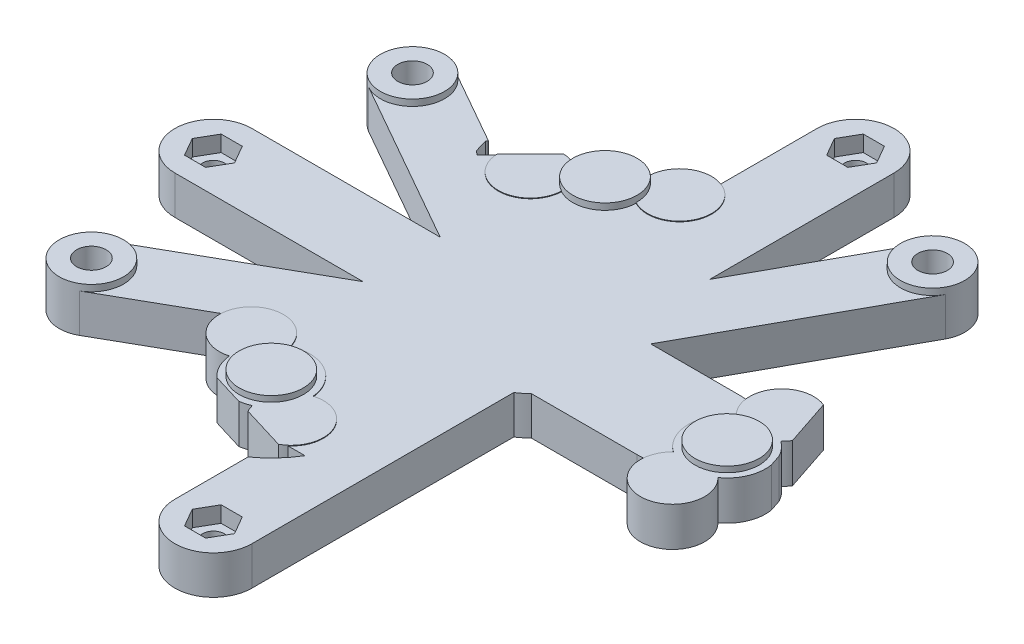
from build123d import *
from build123d.topology import SkipClean

# Parameters (mm, degrees)
BASE_OUTLINE_SKETCH_R          = 3.95
BASE_OUTLINE_SKETCH_R_2        = 1.6
BASE_OUTLINE_SKETCH_R_3        = 3.1
BASE_OUTLINE_SKETCH_R_4        = 2.3
BASE_OUTLINE_DEPTH             = 1.4
INTERFACE_PROFILE_2_SKETCH_R   = 3.95
INTERFACE_PROFILE_2_SKETCH_R_2 = 1.6
INTERFACE_PROFILE_2_SKETCH_R_3 = 1.7
INTERFACE_PROFILE_2_SKETCH_R_4 = 2.3
INTERFACE_PROFILE_2_DEPTH      = 0.1
INTERFACE_PROFILE_3_SKETCH_R   = 1.6
INTERFACE_PROFILE_3_SKETCH_R_2 = 1.7
INTERFACE_PROFILE_3_SKETCH_R_3 = 2.3
INTERFACE_PROFILE_3_DEPTH      = 0.5
INTERFACE_PROFILE_4_SKETCH_R   = 1.6
INTERFACE_PROFILE_4_SKETCH_R_2 = 1.7
INTERFACE_PROFILE_4_SKETCH_R_3 = 2.3
INTERFACE_PROFILE_4_DEPTH      = 1.5
INTERFACE_PROFILE_5_SKETCH_R   = 1.6
INTERFACE_PROFILE_5_SKETCH_R_2 = 2.3
INTERFACE_PROFILE_5_DEPTH      = 0.5
INTERFACE_PROFILE_6_SKETCH_R   = 1.1
INTERFACE_PROFILE_6_SKETCH_R_2 = 2.3
INTERFACE_PROFILE_6_DEPTH      = 1.3
INTERFACE_PROFILE_7_SKETCH_R   = 2.3
INTERFACE_PROFILE_7_DEPTH      = 0.7
INTERFACE_PROFILE_8_SKETCH_R   = 5
INTERFACE_PROFILE_8_SKETCH_R_2 = 2.3
INTERFACE_PROFILE_8_DEPTH      = 0.1
INTERFACE_PROFILE_9_SKETCH_R   = 5
INTERFACE_PROFILE_9_SKETCH_R_2 = 2.3
INTERFACE_PROFILE_9_DEPTH      = 0.9


with BuildPart() as part:
    # Base Outline Sketch → Base Outline (new body)
    with BuildSketch(Plane(origin=(0, -71, 0), x_dir=(1, 0, 0), z_dir=(0, 1, 0))):
        with BuildLine():
            Line((-32.291651246, 8), (-46.185295141, 8))
            Line((-46.185295141, 8), (-29.910571703, 37.590406251))
            ThreePointArc((-29.910571703, 37.590406251), (-31.882057497, 44.381079543), (-38.672730789, 42.409593749))
            Line((-38.672730789, 42.409593749), (-50.291651246, 21.284283828))
            Line((-50.291651246, 21.284283828), (-50.291651246, 50))
            ThreePointArc((-50.291651246, 50), (-56.291651246, 56), (-62.291651246, 50))
            Line((-62.291651246, 50), (-62.291651246, 34.954572734))
            ThreePointArc((-62.291651246, 34.954572734), (-66.315093544, 34.625464052), (-68.784082024, 31.431642464))
            ThreePointArc((-68.784082024, 31.431642464), (-68.883668242, 30.913025667), (-68.927999999, 30.386798062))
            ThreePointArc((-68.927999999, 30.386798062), (-73.791651246, 30.310889132), (-76.289215931, 26.136798062))
            ThreePointArc((-76.289215931, 26.136798062), (-77.35512684, 26.559413065), (-78.489286926, 26.728085547))
            Line((-78.489286926, 26.728085547), (-83.649541024, 21.548414964))
            ThreePointArc((-83.649541024, 21.548414964), (-83.643005829, 21.416889138), (-83.633009125, 21.285581035))
            Line((-83.633009125, 21.285581035), (-83.8107686, 21.386580737))
            Line((-83.8107686, 21.386580737), (-85.20343943, 19.988669705))
            Line((-85.20343943, 19.988669705), (-85.757211082, 20.413215201))
            ThreePointArc((-85.757211082, 20.413215201), (-86.105522751, 21.420146909), (-86.383835717, 22.448628496))
            Line((-86.383835717, 22.448628496), (-86.305419253, 22.677221962))
            Line((-86.305419253, 22.677221962), (-86.256166384, 22.776011296))
            Line((-86.256166384, 22.776011296), (-97.821604208, 29.347282787))
            ThreePointArc((-97.821604208, 29.347282787), (-104.638934033, 27.470047038), (-102.761698284, 20.652717213))
            Line((-102.761698284, 20.652717213), (-76.972915989, 6))
            Line((-76.972915989, 6), (-106.291651246, 6))
            ThreePointArc((-106.291651246, 6), (-112.291651246, 0), (-106.291651246, -6))
            Line((-106.291651246, -6), (-76.972915989, -6))
            Line((-76.972915989, -6), (-102.761698284, -20.652717213))
            ThreePointArc((-102.761698284, -20.652717213), (-105.125718578, -26.277416546), (-100.291651246, -30))
            ThreePointArc((-100.291651246, -30), (-99.0142347, -29.834067332), (-97.821604208, -29.347282787))
            Line((-97.821604208, -29.347282787), (-83.633009125, -21.285581035))
            ThreePointArc((-83.633009125, -21.285581035), (-81.833429855, -25.588743588), (-77.266036714, -26.53458364))
            ThreePointArc((-77.266036714, -26.53458364), (-76.660851993, -28.65876199), (-75.328083566, -30.420042925))
            Line((-75.328083566, -30.420042925), (-70.4166073, -31.916610671))
            ThreePointArc((-70.4166073, -31.916610671), (-69.583050502, -31.73234307), (-68.784082024, -31.431642464))
            ThreePointArc((-68.784082024, -31.431642464), (-68.607205612, -31.999326383), (-68.36419026, -32.541999246))
            Line((-68.36419026, -32.541999246), (-61.538896036, -34.621723271))
            ThreePointArc((-61.538896036, -34.621723271), (-61.075070248, -34.33525847), (-60.645188633, -34))
            Line((-60.645188633, -34), (-58.027344867, -34))
            ThreePointArc((-58.027344867, -34), (-59.924361539, -36.5180637), (-62.291651246, -38.600191578))
            Line((-62.291651246, -38.600191578), (-62.291651246, -50))
            ThreePointArc((-62.291651246, -50), (-56.291651246, -56), (-50.291651246, -50))
            Line((-50.291651246, -50), (-50.291651246, -9.219544457))
            ThreePointArc((-50.291651246, -9.219544457), (-49.489348292, -8.644574861), (-48.741816811, -8))
            Line((-48.741816811, -8), (-32.291651246, -8))
            ThreePointArc((-32.291651246, -8), (-31.774449966, -7.983263921), (-31.259412667, -7.933125709))
            ThreePointArc((-31.259412667, -7.933125709), (-24.59824207, -13.204504795), (-22.824835001, -4.897058824))
            ThreePointArc((-22.824835001, -4.897058824), (-20.756368573, -2.315306833), (-20.370627571, 0.970298223))
            Line((-20.370627571, 0.970298223), (-20.9711323, 2.773459598))
            ThreePointArc((-20.9711323, 2.773459598), (-21.771503753, 3.945664284), (-22.824835001, 4.897058824))
            ThreePointArc((-22.824835001, 4.897058824), (-22.387173453, 5.376691952), (-22.015356327, 5.908995993))
            Line((-22.015356327, 5.908995993), (-24.422675355, 13.137556374))
            ThreePointArc((-24.422675355, 13.137556374), (-29.320205782, 12.478423987), (-31.259412667, 7.933125709))
            ThreePointArc((-31.259412667, 7.933125709), (-31.774449966, 7.983263921), (-32.291651246, 8))
        make_face()
        with Locations(Location((-71.291651246, -25.980762114, 0), (0, 0, 270))):
            Circle(BASE_OUTLINE_SKETCH_R, mode=Mode.SUBTRACT)
        with Locations(Location((-63.930435314, -30.230762114, 0), (0, 0, 270))):
            Circle(BASE_OUTLINE_SKETCH_R_2, mode=Mode.SUBTRACT)
        with Locations(Location((-26.291651246, 0, 0), (0, 0, 270))):
            Circle(BASE_OUTLINE_SKETCH_R, mode=Mode.SUBTRACT)
        with Locations(Location((-56.291651246, -50, 0), (0, 0, 270))):
            Circle(BASE_OUTLINE_SKETCH_R_3, mode=Mode.SUBTRACT)
        with Locations(Location((-26.291651246, -8.5, 0), (0, 0, 270))):
            Circle(BASE_OUTLINE_SKETCH_R_2, mode=Mode.SUBTRACT)
        with Locations(Location((-78.652867178, -21.730762114, 0), (0, 0, 270))):
            Circle(BASE_OUTLINE_SKETCH_R_2, mode=Mode.SUBTRACT)
        with Locations(Location((-100.291651246, -25, 0), (0, 0, 270))):
            Circle(BASE_OUTLINE_SKETCH_R_4, mode=Mode.SUBTRACT)
        with Locations(Location((-71.291651246, 25.980762113, 0), (0, 0, 270))):
            Circle(BASE_OUTLINE_SKETCH_R, mode=Mode.SUBTRACT)
        with Locations(Location((-34.291651246, 40, 0), (0, 0, 270))):
            Circle(BASE_OUTLINE_SKETCH_R_4, mode=Mode.SUBTRACT)
        with Locations(Location((-26.291651246, 8.5, 0), (0, 0, 270))):
            Circle(BASE_OUTLINE_SKETCH_R_2, mode=Mode.SUBTRACT)
        with Locations(Location((-63.930435314, 30.230762114, 0), (0, 0, 270))):
            Circle(BASE_OUTLINE_SKETCH_R_2, mode=Mode.SUBTRACT)
        with Locations(Location((-56.291651246, 50, 0), (0, 0, 270))):
            Circle(BASE_OUTLINE_SKETCH_R_3, mode=Mode.SUBTRACT)
        with Locations(Location((-78.652867178, 21.730762114, 0), (0, 0, 270))):
            Circle(BASE_OUTLINE_SKETCH_R_2, mode=Mode.SUBTRACT)
        with Locations(Location((-106.291651246, 0, 0), (0, 0, 270))):
            Circle(BASE_OUTLINE_SKETCH_R_3, mode=Mode.SUBTRACT)
        with Locations(Location((-100.291651246, 25, 0), (0, 0, 270))):
            Circle(BASE_OUTLINE_SKETCH_R_4, mode=Mode.SUBTRACT)
    extrude(amount=BASE_OUTLINE_DEPTH)

    # Interface Profile 2 Sketch → Interface Profile 2 (add)
    with BuildSketch(Plane(origin=(0, -69.6, 0), x_dir=(1, 0, 0), z_dir=(0, 1, 0))):
        with BuildLine():
            Line((-32.291651246, 8), (-46.185295141, 8))
            Line((-46.185295141, 8), (-29.910571703, 37.590406251))
            ThreePointArc((-29.910571703, 37.590406251), (-31.882057497, 44.381079543), (-38.672730789, 42.409593749))
            Line((-38.672730789, 42.409593749), (-50.291651246, 21.284283828))
            Line((-50.291651246, 21.284283828), (-50.291651246, 50))
            ThreePointArc((-50.291651246, 50), (-56.291651246, 56), (-62.291651246, 50))
            Line((-62.291651246, 50), (-62.291651246, 34.954572734))
            ThreePointArc((-62.291651246, 34.954572734), (-66.315093544, 34.625464052), (-68.784082024, 31.431642464))
            ThreePointArc((-68.784082024, 31.431642464), (-68.883668242, 30.913025667), (-68.927999999, 30.386798062))
            ThreePointArc((-68.927999999, 30.386798062), (-73.791651246, 30.310889132), (-76.289215931, 26.136798062))
            ThreePointArc((-76.289215931, 26.136798062), (-77.35512684, 26.559413065), (-78.489286926, 26.728085547))
            Line((-78.489286926, 26.728085547), (-83.649541024, 21.548414964))
            ThreePointArc((-83.649541024, 21.548414964), (-83.643005829, 21.416889138), (-83.633009125, 21.285581035))
            Line((-83.633009125, 21.285581035), (-83.8107686, 21.386580737))
            Line((-83.8107686, 21.386580737), (-85.20343943, 19.988669705))
            Line((-85.20343943, 19.988669705), (-85.757211082, 20.413215201))
            ThreePointArc((-85.757211082, 20.413215201), (-86.105522751, 21.420146909), (-86.383835717, 22.448628496))
            Line((-86.383835717, 22.448628496), (-86.305419253, 22.677221962))
            Line((-86.305419253, 22.677221962), (-86.256166384, 22.776011296))
            Line((-86.256166384, 22.776011296), (-97.821604208, 29.347282787))
            ThreePointArc((-97.821604208, 29.347282787), (-104.638934033, 27.470047038), (-102.761698284, 20.652717213))
            Line((-102.761698284, 20.652717213), (-76.972915989, 6))
            Line((-76.972915989, 6), (-106.291651246, 6))
            ThreePointArc((-106.291651246, 6), (-112.291651246, 0), (-106.291651246, -6))
            Line((-106.291651246, -6), (-76.972915989, -6))
            Line((-76.972915989, -6), (-102.761698284, -20.652717213))
            ThreePointArc((-102.761698284, -20.652717213), (-105.125718578, -26.277416546), (-100.291651246, -30))
            ThreePointArc((-100.291651246, -30), (-99.0142347, -29.834067332), (-97.821604208, -29.347282787))
            Line((-97.821604208, -29.347282787), (-83.633009125, -21.285581035))
            ThreePointArc((-83.633009125, -21.285581035), (-81.833429855, -25.588743588), (-77.266036714, -26.53458364))
            ThreePointArc((-77.266036714, -26.53458364), (-76.660851993, -28.65876199), (-75.328083566, -30.420042925))
            Line((-75.328083566, -30.420042925), (-70.4166073, -31.916610671))
            ThreePointArc((-70.4166073, -31.916610671), (-69.583050502, -31.73234307), (-68.784082024, -31.431642464))
            ThreePointArc((-68.784082024, -31.431642464), (-68.607205612, -31.999326383), (-68.36419026, -32.541999246))
            Line((-68.36419026, -32.541999246), (-61.538896036, -34.621723271))
            ThreePointArc((-61.538896036, -34.621723271), (-61.075070248, -34.33525847), (-60.645188633, -34))
            Line((-60.645188633, -34), (-58.027344867, -34))
            ThreePointArc((-58.027344867, -34), (-59.924361539, -36.5180637), (-62.291651246, -38.600191578))
            Line((-62.291651246, -38.600191578), (-62.291651246, -50))
            ThreePointArc((-62.291651246, -50), (-56.291651246, -56), (-50.291651246, -50))
            Line((-50.291651246, -50), (-50.291651246, -9.219544457))
            ThreePointArc((-50.291651246, -9.219544457), (-49.489348292, -8.644574861), (-48.741816811, -8))
            Line((-48.741816811, -8), (-32.291651246, -8))
            ThreePointArc((-32.291651246, -8), (-31.774449966, -7.983263921), (-31.259412667, -7.933125709))
            ThreePointArc((-31.259412667, -7.933125709), (-24.59824207, -13.204504795), (-22.824835001, -4.897058824))
            ThreePointArc((-22.824835001, -4.897058824), (-20.756368573, -2.315306833), (-20.370627571, 0.970298223))
            Line((-20.370627571, 0.970298223), (-20.9711323, 2.773459598))
            ThreePointArc((-20.9711323, 2.773459598), (-21.771503753, 3.945664284), (-22.824835001, 4.897058824))
            ThreePointArc((-22.824835001, 4.897058824), (-22.387173453, 5.376691952), (-22.015356327, 5.908995993))
            Line((-22.015356327, 5.908995993), (-24.422675355, 13.137556374))
            ThreePointArc((-24.422675355, 13.137556374), (-29.320205782, 12.478423987), (-31.259412667, 7.933125709))
            ThreePointArc((-31.259412667, 7.933125709), (-31.774449966, 7.983263921), (-32.291651246, 8))
        make_face()
        with Locations(Location((-71.291651246, -25.980762114, 0), (0, 0, 270))):
            Circle(INTERFACE_PROFILE_2_SKETCH_R, mode=Mode.SUBTRACT)
        with Locations(Location((-63.930435314, -30.230762114, 0), (0, 0, 270))):
            Circle(INTERFACE_PROFILE_2_SKETCH_R_2, mode=Mode.SUBTRACT)
        with Locations(Location((-26.291651246, 0, 0), (0, 0, 270))):
            Circle(INTERFACE_PROFILE_2_SKETCH_R, mode=Mode.SUBTRACT)
        with Locations(Location((-56.291651246, -50, 0), (0, 0, 270))):
            Circle(INTERFACE_PROFILE_2_SKETCH_R_3, mode=Mode.SUBTRACT)
        with Locations(Location((-56.291651246, 50, 0), (0, 0, 270))):
            Circle(INTERFACE_PROFILE_2_SKETCH_R_3, mode=Mode.SUBTRACT)
        with Locations(Location((-106.291651246, 0, 0), (0, 0, 270))):
            Circle(INTERFACE_PROFILE_2_SKETCH_R_3, mode=Mode.SUBTRACT)
        with Locations(Location((-26.291651246, -8.5, 0), (0, 0, 270))):
            Circle(INTERFACE_PROFILE_2_SKETCH_R_2, mode=Mode.SUBTRACT)
        with Locations(Location((-78.652867178, -21.730762114, 0), (0, 0, 270))):
            Circle(INTERFACE_PROFILE_2_SKETCH_R_2, mode=Mode.SUBTRACT)
        with Locations(Location((-100.291651246, -25, 0), (0, 0, 270))):
            Circle(INTERFACE_PROFILE_2_SKETCH_R_4, mode=Mode.SUBTRACT)
        with Locations(Location((-71.291651246, 25.980762113, 0), (0, 0, 270))):
            Circle(INTERFACE_PROFILE_2_SKETCH_R, mode=Mode.SUBTRACT)
        with Locations(Location((-34.291651246, 40, 0), (0, 0, 270))):
            Circle(INTERFACE_PROFILE_2_SKETCH_R_4, mode=Mode.SUBTRACT)
        with Locations(Location((-26.291651246, 8.5, 0), (0, 0, 270))):
            Circle(INTERFACE_PROFILE_2_SKETCH_R_2, mode=Mode.SUBTRACT)
        with Locations(Location((-63.930435314, 30.230762114, 0), (0, 0, 270))):
            Circle(INTERFACE_PROFILE_2_SKETCH_R_2, mode=Mode.SUBTRACT)
        with Locations(Location((-78.652867178, 21.730762114, 0), (0, 0, 270))):
            Circle(INTERFACE_PROFILE_2_SKETCH_R_2, mode=Mode.SUBTRACT)
        with Locations(Location((-100.291651246, 25, 0), (0, 0, 270))):
            Circle(INTERFACE_PROFILE_2_SKETCH_R_4, mode=Mode.SUBTRACT)
    extrude(amount=INTERFACE_PROFILE_2_DEPTH)

    # Interface Profile 3 Sketch → Interface Profile 3 (add)
    with SkipClean():  # the faces are left unmerged after this step: merging them gives an invalid solid
        with BuildSketch(Plane(origin=(0, -69.5, 0), x_dir=(1, 0, 0), z_dir=(0, 1, 0))):
            with BuildLine():
                Line((-32.291651246, 8), (-46.185295141, 8))
                Line((-46.185295141, 8), (-29.910571703, 37.590406251))
                ThreePointArc((-29.910571703, 37.590406251), (-31.882057497, 44.381079543), (-38.672730789, 42.409593749))
                Line((-38.672730789, 42.409593749), (-50.291651246, 21.284283828))
                Line((-50.291651246, 21.284283828), (-50.291651246, 50))
                ThreePointArc((-50.291651246, 50), (-56.291651246, 56), (-62.291651246, 50))
                Line((-62.291651246, 50), (-62.291651246, 34.954572734))
                ThreePointArc((-62.291651246, 34.954572734), (-66.315093544, 34.625464052), (-68.784082024, 31.431642464))
                ThreePointArc((-68.784082024, 31.431642464), (-68.883668242, 30.913025667), (-68.927999999, 30.386798062))
                ThreePointArc((-68.927999999, 30.386798062), (-73.791651246, 30.310889132), (-76.289215931, 26.136798062))
                ThreePointArc((-76.289215931, 26.136798062), (-77.35512684, 26.559413065), (-78.489286926, 26.728085547))
                Line((-78.489286926, 26.728085547), (-83.649541024, 21.548414964))
                ThreePointArc((-83.649541024, 21.548414964), (-83.643005829, 21.416889138), (-83.633009125, 21.285581035))
                Line((-83.633009125, 21.285581035), (-83.8107686, 21.386580737))
                Line((-83.8107686, 21.386580737), (-85.20343943, 19.988669705))
                Line((-85.20343943, 19.988669705), (-85.757211082, 20.413215201))
                ThreePointArc((-85.757211082, 20.413215201), (-86.105522751, 21.420146909), (-86.383835717, 22.448628496))
                Line((-86.383835717, 22.448628496), (-86.305419253, 22.677221962))
                Line((-86.305419253, 22.677221962), (-86.256166384, 22.776011296))
                Line((-86.256166384, 22.776011296), (-97.821604208, 29.347282787))
                ThreePointArc((-97.821604208, 29.347282787), (-104.638934033, 27.470047038), (-102.761698284, 20.652717213))
                Line((-102.761698284, 20.652717213), (-76.972915989, 6))
                Line((-76.972915989, 6), (-106.291651246, 6))
                ThreePointArc((-106.291651246, 6), (-112.291651246, 0), (-106.291651246, -6))
                Line((-106.291651246, -6), (-76.972915989, -6))
                Line((-76.972915989, -6), (-102.761698284, -20.652717213))
                ThreePointArc((-102.761698284, -20.652717213), (-105.125718578, -26.277416546), (-100.291651246, -30))
                ThreePointArc((-100.291651246, -30), (-99.0142347, -29.834067332), (-97.821604208, -29.347282787))
                Line((-97.821604208, -29.347282787), (-83.633009125, -21.285581035))
                ThreePointArc((-83.633009125, -21.285581035), (-81.833429855, -25.588743588), (-77.266036714, -26.53458364))
                ThreePointArc((-77.266036714, -26.53458364), (-76.660851993, -28.65876199), (-75.328083566, -30.420042925))
                Line((-75.328083566, -30.420042925), (-70.4166073, -31.916610671))
                ThreePointArc((-70.4166073, -31.916610671), (-69.583050502, -31.73234307), (-68.784082024, -31.431642464))
                ThreePointArc((-68.784082024, -31.431642464), (-68.607205612, -31.999326383), (-68.36419026, -32.541999246))
                Line((-68.36419026, -32.541999246), (-61.538896036, -34.621723271))
                ThreePointArc((-61.538896036, -34.621723271), (-61.075070248, -34.33525847), (-60.645188633, -34))
                Line((-60.645188633, -34), (-58.027344867, -34))
                ThreePointArc((-58.027344867, -34), (-59.924361539, -36.5180637), (-62.291651246, -38.600191578))
                Line((-62.291651246, -38.600191578), (-62.291651246, -50))
                ThreePointArc((-62.291651246, -50), (-56.291651246, -56), (-50.291651246, -50))
                Line((-50.291651246, -50), (-50.291651246, -9.219544457))
                ThreePointArc((-50.291651246, -9.219544457), (-49.489348292, -8.644574861), (-48.741816811, -8))
                Line((-48.741816811, -8), (-32.291651246, -8))
                ThreePointArc((-32.291651246, -8), (-31.774449966, -7.983263921), (-31.259412667, -7.933125709))
                ThreePointArc((-31.259412667, -7.933125709), (-24.59824207, -13.204504794), (-22.824835001, -4.897058824))
                ThreePointArc((-22.824835001, -4.897058824), (-20.756368573, -2.315306833), (-20.370627571, 0.970298223))
                Line((-20.370627571, 0.970298223), (-20.9711323, 2.773459598))
                ThreePointArc((-20.9711323, 2.773459598), (-21.771503753, 3.945664284), (-22.824835001, 4.897058824))
                ThreePointArc((-22.824835001, 4.897058824), (-22.387173453, 5.376691952), (-22.015356327, 5.908995993))
                Line((-22.015356327, 5.908995993), (-24.422675355, 13.137556374))
                ThreePointArc((-24.422675355, 13.137556374), (-29.320205782, 12.478423987), (-31.259412667, 7.933125709))
                ThreePointArc((-31.259412667, 7.933125709), (-31.774449966, 7.983263921), (-32.291651246, 8))
            make_face()
            with Locations(Location((-63.930435314, -30.230762114, 0), (0, 0, 270))):
                Circle(INTERFACE_PROFILE_3_SKETCH_R, mode=Mode.SUBTRACT)
            with Locations(Location((-56.291651246, -50, 0), (0, 0, 270))):
                Circle(INTERFACE_PROFILE_3_SKETCH_R_2, mode=Mode.SUBTRACT)
            with Locations(Location((-56.291651246, 50, 0), (0, 0, 270.000000001))):
                Circle(INTERFACE_PROFILE_3_SKETCH_R_2, mode=Mode.SUBTRACT)
            with Locations(Location((-106.291651246, 0, 0), (0, 0, 270))):
                Circle(INTERFACE_PROFILE_3_SKETCH_R_2, mode=Mode.SUBTRACT)
            with Locations(Location((-26.291651246, -8.5, 0), (0, 0, 270))):
                Circle(INTERFACE_PROFILE_3_SKETCH_R, mode=Mode.SUBTRACT)
            with Locations(Location((-78.652867178, -21.730762114, 0), (0, 0, 270))):
                Circle(INTERFACE_PROFILE_3_SKETCH_R, mode=Mode.SUBTRACT)
            with Locations(Location((-100.291651246, -25, 0), (0, 0, 270))):
                Circle(INTERFACE_PROFILE_3_SKETCH_R_3, mode=Mode.SUBTRACT)
            with Locations(Location((-34.291651246, 40, 0), (0, 0, 270.000000001))):
                Circle(INTERFACE_PROFILE_3_SKETCH_R_3, mode=Mode.SUBTRACT)
            with Locations(Location((-26.291651246, 8.5, 0), (0, 0, 270))):
                Circle(INTERFACE_PROFILE_3_SKETCH_R, mode=Mode.SUBTRACT)
            with Locations(Location((-63.930435314, 30.230762114, 0), (0, 0, 270.000000001))):
                Circle(INTERFACE_PROFILE_3_SKETCH_R, mode=Mode.SUBTRACT)
            with Locations(Location((-78.652867178, 21.730762114, 0), (0, 0, 270))):
                Circle(INTERFACE_PROFILE_3_SKETCH_R, mode=Mode.SUBTRACT)
            with Locations(Location((-100.291651246, 25, 0), (0, 0, 270))):
                Circle(INTERFACE_PROFILE_3_SKETCH_R_3, mode=Mode.SUBTRACT)
            with BuildLine():
                Line((-70.802674502, -29.900379664), (-74.93062799, -27.517104607))
                ThreePointArc((-74.93062799, -27.517104607), (-72.075405627, -22.109298686), (-67.341651246, -25.980762114))
                ThreePointArc((-67.341651246, -25.980762114), (-68.330742759, -28.595245032), (-70.802674502, -29.900379664))
            make_face(mode=Mode.SUBTRACT)
            with BuildLine():
                Line((-23.141651246, 2.383275058), (-23.141651246, -2.383275058))
                ThreePointArc((-23.141651246, -2.383275058), (-30.241651246, 0), (-23.141651246, 2.383275058))
            make_face(mode=Mode.SUBTRACT)
            with BuildLine():
                Line((-74.93062799, 27.517104607), (-70.802674502, 29.900379664))
                ThreePointArc((-70.802674502, 29.900379664), (-68.330742759, 28.595245032), (-67.341651246, 25.980762114))
                ThreePointArc((-67.341651246, 25.980762114), (-72.075405627, 22.109298686), (-74.93062799, 27.517104607))
            make_face(mode=Mode.SUBTRACT)
        extrude(amount=INTERFACE_PROFILE_3_DEPTH)

    # Interface Profile 4 Sketch → Interface Profile 4 (add)
    with SkipClean():  # the faces are left unmerged after this step: merging them gives an invalid solid
        with BuildSketch(Plane(origin=(0, -69, 0), x_dir=(1, 0, 0), z_dir=(0, 1, 0))):
            with BuildLine():
                Line((-32.291651246, 8), (-46.185295141, 8))
                Line((-46.185295141, 8), (-29.910571703, 37.590406251))
                ThreePointArc((-29.910571703, 37.590406251), (-31.882057497, 44.381079543), (-38.672730789, 42.409593749))
                Line((-38.672730789, 42.409593749), (-50.291651246, 21.284283828))
                Line((-50.291651246, 21.284283828), (-50.291651246, 50))
                ThreePointArc((-50.291651246, 50), (-56.291651246, 56), (-62.291651246, 50))
                Line((-62.291651246, 50), (-62.291651246, 34.954572734))
                ThreePointArc((-62.291651246, 34.954572734), (-66.315093544, 34.625464052), (-68.784082024, 31.431642464))
                ThreePointArc((-68.784082024, 31.431642464), (-68.883668242, 30.913025667), (-68.927999999, 30.386798062))
                ThreePointArc((-68.927999999, 30.386798062), (-73.791651246, 30.310889132), (-76.289215931, 26.136798062))
                ThreePointArc((-76.289215931, 26.136798062), (-77.35512684, 26.559413065), (-78.489286926, 26.728085547))
                Line((-78.489286926, 26.728085547), (-83.649541024, 21.548414964))
                ThreePointArc((-83.649541024, 21.548414964), (-83.643005829, 21.416889138), (-83.633009125, 21.285581035))
                Line((-83.633009125, 21.285581035), (-83.8107686, 21.386580737))
                Line((-83.8107686, 21.386580737), (-85.20343943, 19.988669705))
                Line((-85.20343943, 19.988669705), (-85.757211082, 20.413215201))
                ThreePointArc((-85.757211082, 20.413215201), (-86.105522751, 21.420146909), (-86.383835717, 22.448628496))
                Line((-86.383835717, 22.448628496), (-86.305419253, 22.677221962))
                Line((-86.305419253, 22.677221962), (-86.256166384, 22.776011296))
                Line((-86.256166384, 22.776011296), (-97.821604208, 29.347282787))
                ThreePointArc((-97.821604208, 29.347282787), (-104.638934033, 27.470047038), (-102.761698284, 20.652717213))
                Line((-102.761698284, 20.652717213), (-76.972915989, 6))
                Line((-76.972915989, 6), (-106.291651246, 6))
                ThreePointArc((-106.291651246, 6), (-112.291651246, 0), (-106.291651246, -6))
                Line((-106.291651246, -6), (-76.972915989, -6))
                Line((-76.972915989, -6), (-102.761698284, -20.652717213))
                ThreePointArc((-102.761698284, -20.652717213), (-105.125718578, -26.277416546), (-100.291651246, -30))
                ThreePointArc((-100.291651246, -30), (-99.0142347, -29.834067332), (-97.821604208, -29.347282787))
                Line((-97.821604208, -29.347282787), (-83.633009125, -21.285581035))
                ThreePointArc((-83.633009125, -21.285581035), (-81.833429855, -25.588743588), (-77.266036714, -26.53458364))
                ThreePointArc((-77.266036714, -26.53458364), (-76.660851993, -28.65876199), (-75.328083566, -30.420042925))
                Line((-75.328083566, -30.420042925), (-70.4166073, -31.916610671))
                ThreePointArc((-70.4166073, -31.916610671), (-69.583050502, -31.73234307), (-68.784082024, -31.431642464))
                ThreePointArc((-68.784082024, -31.431642464), (-68.607205612, -31.999326383), (-68.36419026, -32.541999246))
                Line((-68.36419026, -32.541999246), (-61.538896036, -34.621723271))
                ThreePointArc((-61.538896036, -34.621723271), (-61.075070248, -34.33525847), (-60.645188633, -34))
                Line((-60.645188633, -34), (-58.027344867, -34))
                ThreePointArc((-58.027344867, -34), (-59.924361539, -36.5180637), (-62.291651246, -38.600191578))
                Line((-62.291651246, -38.600191578), (-62.291651246, -50))
                ThreePointArc((-62.291651246, -50), (-56.291651246, -56), (-50.291651246, -50))
                Line((-50.291651246, -50), (-50.291651246, -9.219544457))
                ThreePointArc((-50.291651246, -9.219544457), (-49.489348292, -8.644574861), (-48.741816811, -8))
                Line((-48.741816811, -8), (-32.291651246, -8))
                ThreePointArc((-32.291651246, -8), (-31.774449966, -7.983263921), (-31.259412667, -7.933125709))
                ThreePointArc((-31.259412667, -7.933125709), (-24.59824207, -13.204504795), (-22.824835001, -4.897058824))
                ThreePointArc((-22.824835001, -4.897058824), (-20.756368573, -2.315306833), (-20.370627571, 0.970298223))
                Line((-20.370627571, 0.970298223), (-20.9711323, 2.773459598))
                ThreePointArc((-20.9711323, 2.773459598), (-21.771503753, 3.945664284), (-22.824835001, 4.897058824))
                ThreePointArc((-22.824835001, 4.897058824), (-22.387173453, 5.376691952), (-22.015356327, 5.908995993))
                Line((-22.015356327, 5.908995993), (-24.422675355, 13.137556374))
                ThreePointArc((-24.422675355, 13.137556374), (-29.320205782, 12.478423987), (-31.259412667, 7.933125709))
                ThreePointArc((-31.259412667, 7.933125709), (-31.774449966, 7.983263921), (-32.291651246, 8))
            make_face()
            with Locations(Location((-63.930435314, -30.230762114, 0), (0, 0, 270))):
                Circle(INTERFACE_PROFILE_4_SKETCH_R, mode=Mode.SUBTRACT)
            with Locations(Location((-56.291651246, -50, 0), (0, 0, 270))):
                Circle(INTERFACE_PROFILE_4_SKETCH_R_2, mode=Mode.SUBTRACT)
            with Locations(Location((-56.291651246, 50, 0), (0, 0, 270))):
                Circle(INTERFACE_PROFILE_4_SKETCH_R_2, mode=Mode.SUBTRACT)
            with Locations(Location((-106.291651246, 0, 0), (0, 0, 270))):
                Circle(INTERFACE_PROFILE_4_SKETCH_R_2, mode=Mode.SUBTRACT)
            with Locations(Location((-26.291651246, -8.5, 0), (0, 0, 270))):
                Circle(INTERFACE_PROFILE_4_SKETCH_R, mode=Mode.SUBTRACT)
            with Locations(Location((-78.652867178, -21.730762114, 0), (0, 0, 270))):
                Circle(INTERFACE_PROFILE_4_SKETCH_R, mode=Mode.SUBTRACT)
            with Locations(Location((-100.291651246, -25, 0), (0, 0, 270))):
                Circle(INTERFACE_PROFILE_4_SKETCH_R_3, mode=Mode.SUBTRACT)
            with Locations(Location((-34.291651246, 40, 0), (0, 0, 270))):
                Circle(INTERFACE_PROFILE_4_SKETCH_R_3, mode=Mode.SUBTRACT)
            with Locations(Location((-26.291651246, 8.5, 0), (0, 0, 270))):
                Circle(INTERFACE_PROFILE_4_SKETCH_R, mode=Mode.SUBTRACT)
            with Locations(Location((-63.930435314, 30.230762114, 0), (0, 0, 270))):
                Circle(INTERFACE_PROFILE_4_SKETCH_R, mode=Mode.SUBTRACT)
            with Locations(Location((-78.652867178, 21.730762114, 0), (0, 0, 270))):
                Circle(INTERFACE_PROFILE_4_SKETCH_R, mode=Mode.SUBTRACT)
            with Locations(Location((-100.291651246, 25, 0), (0, 0, 270))):
                Circle(INTERFACE_PROFILE_4_SKETCH_R_3, mode=Mode.SUBTRACT)
        extrude(amount=INTERFACE_PROFILE_4_DEPTH)

    # Interface Profile 5 Sketch → Interface Profile 5 (add)
    with SkipClean():  # the faces are left unmerged after this step: merging them gives an invalid solid
        with BuildSketch(Plane(origin=(0, -67.5, 0), x_dir=(1, 0, 0), z_dir=(0, 1, 0))):
            with BuildLine():
                Line((-32.291651246, 8), (-46.185295141, 8))
                Line((-46.185295141, 8), (-29.910571703, 37.590406251))
                ThreePointArc((-29.910571703, 37.590406251), (-31.882057497, 44.381079543), (-38.672730789, 42.409593749))
                Line((-38.672730789, 42.409593749), (-50.291651246, 21.284283828))
                Line((-50.291651246, 21.284283828), (-50.291651246, 50))
                ThreePointArc((-50.291651246, 50), (-56.291651246, 56), (-62.291651246, 50))
                Line((-62.291651246, 50), (-62.291651246, 34.954572734))
                ThreePointArc((-62.291651246, 34.954572734), (-66.315093544, 34.625464052), (-68.784082024, 31.431642464))
                ThreePointArc((-68.784082024, 31.431642464), (-68.883668242, 30.913025667), (-68.927999999, 30.386798062))
                ThreePointArc((-68.927999999, 30.386798062), (-73.791651246, 30.310889132), (-76.289215931, 26.136798062))
                ThreePointArc((-76.289215931, 26.136798062), (-77.35512684, 26.559413065), (-78.489286926, 26.728085547))
                Line((-78.489286926, 26.728085547), (-83.649541024, 21.548414964))
                ThreePointArc((-83.649541024, 21.548414964), (-83.643005829, 21.416889138), (-83.633009125, 21.285581035))
                Line((-83.633009125, 21.285581035), (-83.8107686, 21.386580737))
                Line((-83.8107686, 21.386580737), (-85.20343943, 19.988669705))
                Line((-85.20343943, 19.988669705), (-85.757211082, 20.413215201))
                ThreePointArc((-85.757211082, 20.413215201), (-86.105522751, 21.420146909), (-86.383835717, 22.448628496))
                Line((-86.383835717, 22.448628496), (-86.305419253, 22.677221962))
                Line((-86.305419253, 22.677221962), (-86.256166384, 22.776011296))
                Line((-86.256166384, 22.776011296), (-97.821604208, 29.347282787))
                ThreePointArc((-97.821604208, 29.347282787), (-104.638934033, 27.470047038), (-102.761698284, 20.652717213))
                Line((-102.761698284, 20.652717213), (-76.972915989, 6))
                Line((-76.972915989, 6), (-106.291651246, 6))
                ThreePointArc((-106.291651246, 6), (-112.291651246, 0), (-106.291651246, -6))
                Line((-106.291651246, -6), (-76.972915989, -6))
                Line((-76.972915989, -6), (-102.761698284, -20.652717213))
                ThreePointArc((-102.761698284, -20.652717213), (-105.125718578, -26.277416546), (-100.291651246, -30))
                ThreePointArc((-100.291651246, -30), (-99.0142347, -29.834067332), (-97.821604208, -29.347282787))
                Line((-97.821604208, -29.347282787), (-83.633009125, -21.285581035))
                ThreePointArc((-83.633009125, -21.285581035), (-81.833429855, -25.588743588), (-77.266036714, -26.53458364))
                ThreePointArc((-77.266036714, -26.53458364), (-76.660851993, -28.65876199), (-75.328083566, -30.420042925))
                Line((-75.328083566, -30.420042925), (-70.4166073, -31.916610671))
                ThreePointArc((-70.4166073, -31.916610671), (-69.583050502, -31.73234307), (-68.784082024, -31.431642464))
                ThreePointArc((-68.784082024, -31.431642464), (-68.607205612, -31.999326383), (-68.36419026, -32.541999246))
                Line((-68.36419026, -32.541999246), (-61.538896036, -34.621723271))
                ThreePointArc((-61.538896036, -34.621723271), (-61.075070248, -34.33525847), (-60.645188633, -34))
                Line((-60.645188633, -34), (-58.027344867, -34))
                ThreePointArc((-58.027344867, -34), (-59.924361539, -36.5180637), (-62.291651246, -38.600191578))
                Line((-62.291651246, -38.600191578), (-62.291651246, -50))
                ThreePointArc((-62.291651246, -50), (-56.291651246, -56), (-50.291651246, -50))
                Line((-50.291651246, -50), (-50.291651246, -9.219544457))
                ThreePointArc((-50.291651246, -9.219544457), (-49.489348292, -8.644574861), (-48.741816811, -8))
                Line((-48.741816811, -8), (-32.291651246, -8))
                ThreePointArc((-32.291651246, -8), (-31.774449966, -7.983263921), (-31.259412667, -7.933125709))
                ThreePointArc((-31.259412667, -7.933125709), (-24.59824207, -13.204504795), (-22.824835001, -4.897058824))
                ThreePointArc((-22.824835001, -4.897058824), (-20.756368573, -2.315306833), (-20.370627571, 0.970298223))
                Line((-20.370627571, 0.970298223), (-20.9711323, 2.773459598))
                ThreePointArc((-20.9711323, 2.773459598), (-21.771503753, 3.945664284), (-22.824835001, 4.897058824))
                ThreePointArc((-22.824835001, 4.897058824), (-22.387173453, 5.376691952), (-22.015356327, 5.908995993))
                Line((-22.015356327, 5.908995993), (-24.422675355, 13.137556374))
                ThreePointArc((-24.422675355, 13.137556374), (-29.320205782, 12.478423987), (-31.259412667, 7.933125709))
                ThreePointArc((-31.259412667, 7.933125709), (-31.774449966, 7.983263921), (-32.291651246, 8))
            make_face()
            with Locations(Location((-63.930435314, -30.230762114, 0), (0, 0, 270))):
                Circle(INTERFACE_PROFILE_5_SKETCH_R, mode=Mode.SUBTRACT)
            with Locations(Location((-26.291651246, -8.5, 0), (0, 0, 270))):
                Circle(INTERFACE_PROFILE_5_SKETCH_R, mode=Mode.SUBTRACT)
            with Locations(Location((-78.652867178, -21.730762114, 0), (0, 0, 270))):
                Circle(INTERFACE_PROFILE_5_SKETCH_R, mode=Mode.SUBTRACT)
            with Locations(Location((-100.291651246, -25, 0), (0, 0, 270))):
                Circle(INTERFACE_PROFILE_5_SKETCH_R_2, mode=Mode.SUBTRACT)
            with Locations(Location((-34.291651246, 40, 0), (0, 0, 270))):
                Circle(INTERFACE_PROFILE_5_SKETCH_R_2, mode=Mode.SUBTRACT)
            with Locations(Location((-26.291651246, 8.5, 0), (0, 0, 270))):
                Circle(INTERFACE_PROFILE_5_SKETCH_R, mode=Mode.SUBTRACT)
            with Locations(Location((-63.930435314, 30.230762114, 0), (0, 0, 270))):
                Circle(INTERFACE_PROFILE_5_SKETCH_R, mode=Mode.SUBTRACT)
            with Locations(Location((-78.652867178, 21.730762114, 0), (0, 0, 270))):
                Circle(INTERFACE_PROFILE_5_SKETCH_R, mode=Mode.SUBTRACT)
            with Locations(Location((-100.291651246, 25, 0), (0, 0, 270))):
                Circle(INTERFACE_PROFILE_5_SKETCH_R_2, mode=Mode.SUBTRACT)
            Polygon((-59.58254778, -50), (-57.937099513, -47.15), (-54.646202979, -47.15), (-53.000754712, -50), (-54.646202979, -52.85), (-57.937099513, -52.85), align=None, mode=Mode.SUBTRACT)
            Polygon((-54.646202979, 52.85), (-53.000754712, 50), (-54.646202979, 47.15), (-57.937099513, 47.15), (-59.58254778, 50), (-57.937099513, 52.85), align=None, mode=Mode.SUBTRACT)
            Polygon((-104.646202979, 2.85), (-103.000754712, 0), (-104.646202979, -2.85), (-107.937099513, -2.85), (-109.58254778, 0), (-107.937099513, 2.85), align=None, mode=Mode.SUBTRACT)
        extrude(amount=INTERFACE_PROFILE_5_DEPTH)

    # Interface Profile 6 Sketch → Interface Profile 6 (add)
    with SkipClean():  # the faces are left unmerged after this step: merging them gives an invalid solid
        with BuildSketch(Plane(origin=(0, -67, 0), x_dir=(1, 0, 0), z_dir=(0, 1, 0))):
            with BuildLine():
                Line((-32.291651246, 8), (-46.185295141, 8))
                Line((-46.185295141, 8), (-29.910571703, 37.590406251))
                ThreePointArc((-29.910571703, 37.590406251), (-31.882057497, 44.381079543), (-38.672730789, 42.409593749))
                Line((-38.672730789, 42.409593749), (-50.291651246, 21.284283828))
                Line((-50.291651246, 21.284283828), (-50.291651246, 50))
                ThreePointArc((-50.291651246, 50), (-56.291651246, 56), (-62.291651246, 50))
                Line((-62.291651246, 50), (-62.291651246, 34.954572734))
                ThreePointArc((-62.291651246, 34.954572734), (-66.315093544, 34.625464052), (-68.784082024, 31.431642464))
                ThreePointArc((-68.784082024, 31.431642464), (-68.883668242, 30.913025667), (-68.927999999, 30.386798062))
                ThreePointArc((-68.927999999, 30.386798062), (-73.791651246, 30.310889132), (-76.289215931, 26.136798062))
                ThreePointArc((-76.289215931, 26.136798062), (-77.35512684, 26.559413065), (-78.489286926, 26.728085547))
                Line((-78.489286926, 26.728085547), (-83.649541024, 21.548414964))
                ThreePointArc((-83.649541024, 21.548414964), (-83.643005829, 21.416889138), (-83.633009125, 21.285581035))
                Line((-83.633009125, 21.285581035), (-83.8107686, 21.386580737))
                Line((-83.8107686, 21.386580737), (-85.20343943, 19.988669705))
                Line((-85.20343943, 19.988669705), (-85.757211082, 20.413215201))
                ThreePointArc((-85.757211082, 20.413215201), (-86.105522751, 21.420146909), (-86.383835717, 22.448628496))
                Line((-86.383835717, 22.448628496), (-86.305419253, 22.677221962))
                Line((-86.305419253, 22.677221962), (-86.256166384, 22.776011296))
                Line((-86.256166384, 22.776011296), (-97.821604208, 29.347282787))
                ThreePointArc((-97.821604208, 29.347282787), (-104.638934033, 27.470047038), (-102.761698284, 20.652717213))
                Line((-102.761698284, 20.652717213), (-76.972915989, 6))
                Line((-76.972915989, 6), (-106.291651246, 6))
                ThreePointArc((-106.291651246, 6), (-112.291651246, 0), (-106.291651246, -6))
                Line((-106.291651246, -6), (-76.972915989, -6))
                Line((-76.972915989, -6), (-102.761698284, -20.652717213))
                ThreePointArc((-102.761698284, -20.652717213), (-105.125718578, -26.277416546), (-100.291651246, -30))
                ThreePointArc((-100.291651246, -30), (-99.0142347, -29.834067332), (-97.821604208, -29.347282787))
                Line((-97.821604208, -29.347282787), (-83.633009125, -21.285581035))
                ThreePointArc((-83.633009125, -21.285581035), (-81.833429855, -25.588743588), (-77.266036714, -26.53458364))
                ThreePointArc((-77.266036714, -26.53458364), (-76.660851993, -28.65876199), (-75.328083566, -30.420042925))
                Line((-75.328083566, -30.420042925), (-70.4166073, -31.916610671))
                ThreePointArc((-70.4166073, -31.916610671), (-69.583050502, -31.73234307), (-68.784082024, -31.431642464))
                ThreePointArc((-68.784082024, -31.431642464), (-68.607205612, -31.999326383), (-68.36419026, -32.541999246))
                Line((-68.36419026, -32.541999246), (-61.538896036, -34.621723271))
                ThreePointArc((-61.538896036, -34.621723271), (-61.075070248, -34.33525847), (-60.645188633, -34))
                Line((-60.645188633, -34), (-58.027344867, -34))
                ThreePointArc((-58.027344867, -34), (-59.924361539, -36.5180637), (-62.291651246, -38.600191578))
                Line((-62.291651246, -38.600191578), (-62.291651246, -50))
                ThreePointArc((-62.291651246, -50), (-56.291651246, -56), (-50.291651246, -50))
                Line((-50.291651246, -50), (-50.291651246, -9.219544457))
                ThreePointArc((-50.291651246, -9.219544457), (-49.489348292, -8.644574861), (-48.741816811, -8))
                Line((-48.741816811, -8), (-32.291651246, -8))
                ThreePointArc((-32.291651246, -8), (-31.774449966, -7.983263921), (-31.259412667, -7.933125709))
                ThreePointArc((-31.259412667, -7.933125709), (-24.59824207, -13.204504795), (-22.824835001, -4.897058824))
                ThreePointArc((-22.824835001, -4.897058824), (-20.756368573, -2.315306833), (-20.370627571, 0.970298223))
                Line((-20.370627571, 0.970298223), (-20.9711323, 2.773459598))
                ThreePointArc((-20.9711323, 2.773459598), (-21.771503753, 3.945664284), (-22.824835001, 4.897058823))
                ThreePointArc((-22.824835001, 4.897058823), (-22.387173453, 5.376691952), (-22.015356327, 5.908995993))
                Line((-22.015356327, 5.908995993), (-24.422675355, 13.137556374))
                ThreePointArc((-24.422675355, 13.137556374), (-29.320205782, 12.478423987), (-31.259412667, 7.933125709))
                ThreePointArc((-31.259412667, 7.933125709), (-31.774449966, 7.983263921), (-32.291651246, 8))
            make_face()
            with Locations(Location((-63.930435314, -30.230762114, 0), (0, 0, 270))):
                Circle(INTERFACE_PROFILE_6_SKETCH_R, mode=Mode.SUBTRACT)
            with Locations(Location((-26.291651246, -8.5, 0), (0, 0, 270))):
                Circle(INTERFACE_PROFILE_6_SKETCH_R, mode=Mode.SUBTRACT)
            with Locations(Location((-78.652867178, -21.730762114, 0), (0, 0, 270))):
                Circle(INTERFACE_PROFILE_6_SKETCH_R, mode=Mode.SUBTRACT)
            with Locations(Location((-100.291651246, -25, 0), (0, 0, 270))):
                Circle(INTERFACE_PROFILE_6_SKETCH_R_2, mode=Mode.SUBTRACT)
            with Locations(Location((-34.291651246, 40, 0), (0, 0, 270))):
                Circle(INTERFACE_PROFILE_6_SKETCH_R_2, mode=Mode.SUBTRACT)
            with Locations(Location((-26.291651246, 8.5, 0), (0, 0, 270))):
                Circle(INTERFACE_PROFILE_6_SKETCH_R, mode=Mode.SUBTRACT)
            with Locations(Location((-63.930435314, 30.230762113, 0), (0, 0, 270))):
                Circle(INTERFACE_PROFILE_6_SKETCH_R, mode=Mode.SUBTRACT)
            with Locations(Location((-78.652867178, 21.730762114, 0), (0, 0, 270))):
                Circle(INTERFACE_PROFILE_6_SKETCH_R, mode=Mode.SUBTRACT)
            with Locations(Location((-100.291651246, 25, 0), (0, 0, 270))):
                Circle(INTERFACE_PROFILE_6_SKETCH_R_2, mode=Mode.SUBTRACT)
            Polygon((-59.58254778, -50), (-57.937099513, -47.15), (-54.646202979, -47.15), (-53.000754712, -50), (-54.646202979, -52.85), (-57.937099513, -52.85), align=None, mode=Mode.SUBTRACT)
            Polygon((-54.646202979, 52.85), (-53.000754712, 50), (-54.646202979, 47.15), (-57.937099513, 47.15), (-59.58254778, 50), (-57.937099513, 52.85), align=None, mode=Mode.SUBTRACT)
            Polygon((-104.646202979, 2.85), (-103.000754712, 0), (-104.646202979, -2.85), (-107.937099513, -2.85), (-109.58254778, 0), (-107.937099513, 2.85), align=None, mode=Mode.SUBTRACT)
        extrude(amount=INTERFACE_PROFILE_6_DEPTH)

    # Interface Profile 7 Sketch → Interface Profile 7 (add)
    with SkipClean():  # the faces are left unmerged after this step: merging them gives an invalid solid
        with BuildSketch(Plane(origin=(0, -65.7, 0), x_dir=(1, 0, 0), z_dir=(0, 1, 0))):
            with BuildLine():
                Line((-32.291651246, 8), (-46.185295141, 8))
                Line((-46.185295141, 8), (-29.910571703, 37.590406251))
                ThreePointArc((-29.910571703, 37.590406251), (-31.882057497, 44.381079543), (-38.672730789, 42.409593749))
                Line((-38.672730789, 42.409593749), (-50.291651246, 21.284283828))
                Line((-50.291651246, 21.284283828), (-50.291651246, 50))
                ThreePointArc((-50.291651246, 50), (-56.291651246, 56), (-62.291651246, 50))
                Line((-62.291651246, 50), (-62.291651246, 34.954572734))
                ThreePointArc((-62.291651246, 34.954572734), (-66.315093544, 34.625464052), (-68.784082024, 31.431642464))
                ThreePointArc((-68.784082024, 31.431642464), (-68.883668242, 30.913025667), (-68.927999999, 30.386798062))
                ThreePointArc((-68.927999999, 30.386798062), (-73.791651246, 30.310889132), (-76.289215931, 26.136798062))
                ThreePointArc((-76.289215931, 26.136798062), (-77.35512684, 26.559413065), (-78.489286926, 26.728085547))
                Line((-78.489286926, 26.728085547), (-83.649541024, 21.548414964))
                ThreePointArc((-83.649541024, 21.548414964), (-83.643005829, 21.416889138), (-83.633009125, 21.285581035))
                Line((-83.633009125, 21.285581035), (-83.8107686, 21.386580737))
                Line((-83.8107686, 21.386580737), (-85.20343943, 19.988669705))
                Line((-85.20343943, 19.988669705), (-85.757211082, 20.413215201))
                ThreePointArc((-85.757211082, 20.413215201), (-86.105522751, 21.420146909), (-86.383835717, 22.448628496))
                Line((-86.383835717, 22.448628496), (-86.305419253, 22.677221962))
                Line((-86.305419253, 22.677221962), (-86.256166384, 22.776011296))
                Line((-86.256166384, 22.776011296), (-97.821604208, 29.347282787))
                ThreePointArc((-97.821604208, 29.347282787), (-104.638934033, 27.470047038), (-102.761698284, 20.652717213))
                Line((-102.761698284, 20.652717213), (-76.972915989, 6))
                Line((-76.972915989, 6), (-106.291651246, 6))
                ThreePointArc((-106.291651246, 6), (-112.291651246, 0), (-106.291651246, -6))
                Line((-106.291651246, -6), (-76.972915989, -6))
                Line((-76.972915989, -6), (-102.761698284, -20.652717213))
                ThreePointArc((-102.761698284, -20.652717213), (-105.125718578, -26.277416546), (-100.291651246, -30))
                ThreePointArc((-100.291651246, -30), (-99.0142347, -29.834067332), (-97.821604208, -29.347282787))
                Line((-97.821604208, -29.347282787), (-83.633009125, -21.285581035))
                ThreePointArc((-83.633009125, -21.285581035), (-81.833429855, -25.588743588), (-77.266036714, -26.53458364))
                ThreePointArc((-77.266036714, -26.53458364), (-76.660851993, -28.65876199), (-75.328083566, -30.420042925))
                Line((-75.328083566, -30.420042925), (-70.4166073, -31.916610671))
                ThreePointArc((-70.4166073, -31.916610671), (-69.583050502, -31.73234307), (-68.784082024, -31.431642464))
                ThreePointArc((-68.784082024, -31.431642464), (-68.607205612, -31.999326383), (-68.36419026, -32.541999246))
                Line((-68.36419026, -32.541999246), (-61.538896036, -34.621723271))
                ThreePointArc((-61.538896036, -34.621723271), (-61.075070248, -34.33525847), (-60.645188633, -34))
                Line((-60.645188633, -34), (-58.027344867, -34))
                ThreePointArc((-58.027344867, -34), (-59.924361539, -36.5180637), (-62.291651246, -38.600191578))
                Line((-62.291651246, -38.600191578), (-62.291651246, -50))
                ThreePointArc((-62.291651246, -50), (-56.291651246, -56), (-50.291651246, -50))
                Line((-50.291651246, -50), (-50.291651246, -9.219544457))
                ThreePointArc((-50.291651246, -9.219544457), (-49.489348292, -8.644574861), (-48.741816811, -8))
                Line((-48.741816811, -8), (-32.291651246, -8))
                ThreePointArc((-32.291651246, -8), (-31.774449966, -7.983263921), (-31.259412667, -7.933125709))
                ThreePointArc((-31.259412667, -7.933125709), (-24.59824207, -13.204504795), (-22.824835001, -4.897058824))
                ThreePointArc((-22.824835001, -4.897058824), (-20.756368573, -2.315306833), (-20.370627571, 0.970298223))
                Line((-20.370627571, 0.970298223), (-20.9711323, 2.773459598))
                ThreePointArc((-20.9711323, 2.773459598), (-21.771503753, 3.945664284), (-22.824835001, 4.897058824))
                ThreePointArc((-22.824835001, 4.897058824), (-22.387173453, 5.376691952), (-22.015356327, 5.908995993))
                Line((-22.015356327, 5.908995993), (-24.422675355, 13.137556374))
                ThreePointArc((-24.422675355, 13.137556374), (-29.320205782, 12.478423987), (-31.259412667, 7.933125709))
                ThreePointArc((-31.259412667, 7.933125709), (-31.774449966, 7.983263921), (-32.291651246, 8))
            make_face()
            with Locations(Location((-100.291651246, -25, 0), (0, 0, 270))):
                Circle(INTERFACE_PROFILE_7_SKETCH_R, mode=Mode.SUBTRACT)
            with Locations(Location((-34.291651246, 40, 0), (0, 0, 270))):
                Circle(INTERFACE_PROFILE_7_SKETCH_R, mode=Mode.SUBTRACT)
            with Locations(Location((-100.291651246, 25, 0), (0, 0, 270))):
                Circle(INTERFACE_PROFILE_7_SKETCH_R, mode=Mode.SUBTRACT)
            Polygon((-59.58254778, -50), (-57.937099513, -47.15), (-54.646202979, -47.15), (-53.000754712, -50), (-54.646202979, -52.85), (-57.937099513, -52.85), align=None, mode=Mode.SUBTRACT)
            Polygon((-54.646202979, 52.85), (-53.000754712, 50), (-54.646202979, 47.15), (-57.937099513, 47.15), (-59.58254778, 50), (-57.937099513, 52.85), align=None, mode=Mode.SUBTRACT)
            Polygon((-104.646202979, 2.85), (-103.000754712, 0), (-104.646202979, -2.85), (-107.937099513, -2.85), (-109.58254778, 0), (-107.937099513, 2.85), align=None, mode=Mode.SUBTRACT)
        extrude(amount=INTERFACE_PROFILE_7_DEPTH)

    # Interface Profile 8 Sketch → Interface Profile 8 (add)
    # profile 1 of 6: a face of its own
    with BuildSketch(Plane(origin=(0, -65, 0), x_dir=(1, 0, 0), z_dir=(0, 1, 0))):
        with Locations(Location((-100.291651246, 25, 0), (0, 0, 60.395549254))):
            Circle(INTERFACE_PROFILE_8_SKETCH_R)
        with Locations(Location((-100.291651246, 25, 0), (0, 0, 270))):
            Circle(INTERFACE_PROFILE_8_SKETCH_R_2, mode=Mode.SUBTRACT)
    # profile 2 of 6: a face of its own
    with BuildSketch(Plane(origin=(0, -65, 0), x_dir=(1, 0, 0), z_dir=(0, 1, 0))):
        with Locations(Location((-34.291651246, 40, 0), (0, 0, 151.189206257))):
            Circle(INTERFACE_PROFILE_8_SKETCH_R)
        with Locations(Location((-34.291651246, 40, 0), (0, 0, 270.000000001))):
            Circle(INTERFACE_PROFILE_8_SKETCH_R_2, mode=Mode.SUBTRACT)
    # profile 3 of 6: a face of its own
    with BuildSketch(Plane(origin=(0, -65, 0), x_dir=(1, 0, 0), z_dir=(0, 1, 0))):
        with BuildLine():
            Line((-24.422675355, 13.137556374), (-22.015356327, 5.908995993))
            ThreePointArc((-22.015356327, 5.908995993), (-22.387173453, 5.376691952), (-22.824835001, 4.897058824))
            ThreePointArc((-22.824835001, 4.897058824), (-21.771503753, 3.945664284), (-20.9711323, 2.773459598))
            Line((-20.9711323, 2.773459598), (-20.370627571, 0.970298223))
            ThreePointArc((-20.370627571, 0.970298223), (-20.756368573, -2.315306833), (-22.824835001, -4.897058824))
            ThreePointArc((-22.824835001, -4.897058824), (-26.291651246, -13.5), (-29.758467491, -4.897058824))
            ThreePointArc((-29.758467491, -4.897058824), (-32.291651246, 0), (-29.758467491, 4.897058824))
            ThreePointArc((-29.758467491, 4.897058824), (-30.48864105, 11.217586536), (-24.422675355, 13.137556374))
        make_face()
    # profile 4 of 6: a face of its own
    with BuildSketch(Plane(origin=(0, -65, 0), x_dir=(1, 0, 0), z_dir=(0, 1, 0))):
        with BuildLine():
            Line((-61.538896036, -34.621723271), (-68.36419026, -32.541999246))
            ThreePointArc((-68.36419026, -32.541999246), (-68.607205612, -31.999326383), (-68.784082024, -31.431642464))
            ThreePointArc((-68.784082024, -31.431642464), (-69.583050502, -31.73234307), (-70.4166073, -31.916610671))
            Line((-70.4166073, -31.916610671), (-75.328083566, -30.420042925))
            ThreePointArc((-75.328083566, -30.420042925), (-76.660851993, -28.65876199), (-77.266036714, -26.53458364))
            ThreePointArc((-77.266036714, -26.53458364), (-82.982994197, -19.230762114), (-73.799220468, -20.529881763))
            ThreePointArc((-73.799220468, -20.529881763), (-68.291651246, -20.784609691), (-65.317265778, -25.426940587))
            ThreePointArc((-65.317265778, -25.426940587), (-59.305679417, -28.330332452), (-61.538896036, -34.621723271))
        make_face()
    # profile 5 of 6: a face of its own
    with BuildSketch(Plane(origin=(0, -65, 0), x_dir=(1, 0, 0), z_dir=(0, 1, 0))):
        with BuildLine():
            Line((-83.649541024, 21.548414964), (-78.489286926, 26.728085547))
            ThreePointArc((-78.489286926, 26.728085547), (-77.35512684, 26.559413065), (-76.289215931, 26.136798062))
            ThreePointArc((-76.289215931, 26.136798062), (-73.791651246, 30.310889132), (-68.927999999, 30.386798062))
            ThreePointArc((-68.927999999, 30.386798062), (-68.883668242, 30.913025667), (-68.784082024, 31.431642464))
            ThreePointArc((-68.784082024, 31.431642464), (-59.600308295, 32.730762114), (-65.317265778, 25.426940587))
            ThreePointArc((-65.317265778, 25.426940587), (-65.816194208, 25.60000479), (-66.294086561, 25.824726165))
            ThreePointArc((-66.294086561, 25.824726165), (-68.791651246, 21.650635095), (-73.655302493, 21.574726165))
            ThreePointArc((-73.655302493, 21.574726165), (-78.63970404, 16.73077944), (-83.649541024, 21.548414964))
        make_face()
    # profile 6 of 6: a face of its own
    with BuildSketch(Plane(origin=(0, -65, 0), x_dir=(1, 0, 0), z_dir=(0, 1, 0))):
        with BuildLine():
            ThreePointArc((-100.291651246, -30), (-99.0142347, -29.834067332), (-97.821604208, -29.347282787))
            ThreePointArc((-97.821604208, -29.347282787), (-101.569067792, -20.165932668), (-100.291651246, -30))
        make_face()
        with Locations(Location((-100.291651246, -25, 0), (0, 0, 270))):
            Circle(INTERFACE_PROFILE_8_SKETCH_R_2, mode=Mode.SUBTRACT)
    extrude(amount=INTERFACE_PROFILE_8_DEPTH)

    # Interface Profile 9 Sketch → Interface Profile 9 (add)
    # profile 1 of 6: a face of its own
    with BuildSketch(Plane(origin=(0, -64.9, 0), x_dir=(1, 0, 0), z_dir=(0, 1, 0))):
        with Locations(Location((-71.291651246, -25.980762114, 0), (0, 0, 270))):
            Circle(INTERFACE_PROFILE_9_SKETCH_R)
    # profile 2 of 6: a face of its own
    with BuildSketch(Plane(origin=(0, -64.9, 0), x_dir=(1, 0, 0), z_dir=(0, 1, 0))):
        with Locations(Location((-26.291651246, 0, 0), (0, 0, 270))):
            Circle(INTERFACE_PROFILE_9_SKETCH_R)
    # profile 3 of 6: a face of its own
    with BuildSketch(Plane(origin=(0, -64.9, 0), x_dir=(1, 0, 0), z_dir=(0, 1, 0))):
        with Locations(Location((-100.291651246, 25, 0), (0, 0, 60.395549254))):
            Circle(INTERFACE_PROFILE_9_SKETCH_R)
        with Locations(Location((-100.291651246, 25, 0), (0, 0, 270))):
            Circle(INTERFACE_PROFILE_9_SKETCH_R_2, mode=Mode.SUBTRACT)
    # profile 4 of 6: a face of its own
    with BuildSketch(Plane(origin=(0, -64.9, 0), x_dir=(1, 0, 0), z_dir=(0, 1, 0))):
        with Locations(Location((-71.291651246, 25.980762114, 0), (0, 0, 61.788330617))):
            Circle(INTERFACE_PROFILE_9_SKETCH_R)
    # profile 5 of 6: a face of its own
    with BuildSketch(Plane(origin=(0, -64.9, 0), x_dir=(1, 0, 0), z_dir=(0, 1, 0))):
        with Locations(Location((-34.291651246, 40, 0), (0, 0, 151.189206257))):
            Circle(INTERFACE_PROFILE_9_SKETCH_R)
        with Locations(Location((-34.291651246, 40, 0), (0, 0, 270.000000001))):
            Circle(INTERFACE_PROFILE_9_SKETCH_R_2, mode=Mode.SUBTRACT)
    # profile 6 of 6: a face of its own
    with BuildSketch(Plane(origin=(0, -64.9, 0), x_dir=(1, 0, 0), z_dir=(0, 1, 0))):
        with BuildLine():
            ThreePointArc((-100.291651246, -30), (-99.0142347, -29.834067332), (-97.821604208, -29.347282787))
            ThreePointArc((-97.821604208, -29.347282787), (-101.569067792, -20.165932668), (-100.291651246, -30))
        make_face()
        with Locations(Location((-100.291651246, -25, 0), (0, 0, 270))):
            Circle(INTERFACE_PROFILE_9_SKETCH_R_2, mode=Mode.SUBTRACT)
    extrude(amount=INTERFACE_PROFILE_9_DEPTH)


solid = part.part
